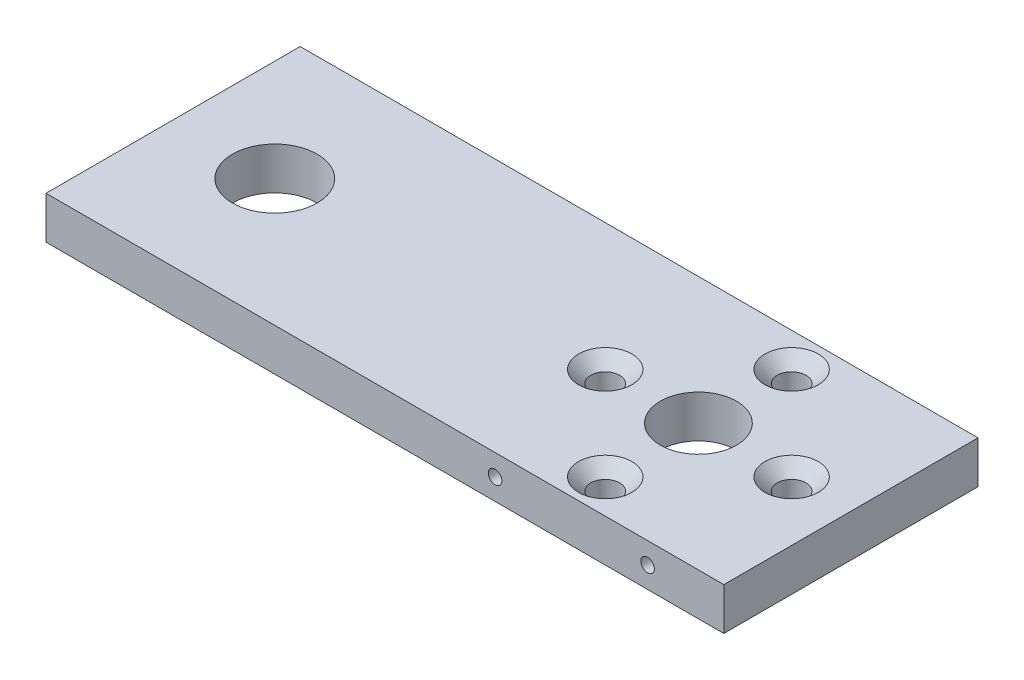
from build123d import *

# Parameters (mm, degrees)
SKETCH1_R                                           = 5
SKETCH1_R_2                                         = 4.5
BOSS_EXTRUDE2_DEPTH                                 = 5
CSK_FOR_M3_COUNTERSUNK_FLAT_HEAD_SCREW2_D           = 3.4
CSK_FOR_M3_COUNTERSUNK_FLAT_HEAD_SCREW2_CSINK_D     = 6.3
CSK_FOR_M3_COUNTERSUNK_FLAT_HEAD_SCREW2_CSINK_ANGLE = 90
CIRPATTERN2_COUNT                                   = 4
M2_TAPPED_HOLE1_D                                   = 1.6
M2_TAPPED_HOLE1_DEPTH                               = 5
M2_TAPPED_HOLE1_TIP                                 = 0.480688495
M2_TAPPED_HOLE2_D                                   = 1.6
M2_TAPPED_HOLE2_DEPTH                               = 5
M2_TAPPED_HOLE2_TIP                                 = 0.480688495


with BuildPart() as part:
    # Sketch1 → Boss-Extrude2 (new body)
    with BuildSketch(Plane(origin=(0, 0, 0), x_dir=(1, 0, 0), z_dir=(0, 1, 0))):
        Polygon((-37.002207947, 0), (-37.002207947, 15), (42.997792053, 15), (42.997792053, -15), (-37.002207947, -15), align=None)
        with Locations((-25, 0)):
            Circle(SKETCH1_R, mode=Mode.SUBTRACT)
        with Locations((25, 0)):
            Circle(SKETCH1_R_2, mode=Mode.SUBTRACT)
    extrude(amount=BOSS_EXTRUDE2_DEPTH)

    # CSK for M3 Countersunk Flat Head Screw2 (through all)
    with Locations(Plane(origin=(0, 5, 0), x_dir=(1, 0, 0), z_dir=(0, 1, 0))):
        with Locations((14, 0)):
            csk_for_m3_countersunk_flat_head_screw2 = CounterSinkHole(CSK_FOR_M3_COUNTERSUNK_FLAT_HEAD_SCREW2_D / 2, CSK_FOR_M3_COUNTERSUNK_FLAT_HEAD_SCREW2_CSINK_D / 2, counter_sink_angle=CSK_FOR_M3_COUNTERSUNK_FLAT_HEAD_SCREW2_CSINK_ANGLE)

    # CirPattern2: CSK for M3 Countersunk Flat Head Screw2 ×4 about axis
    cirpattern2_axis = Axis((25, 23.075275429, 0), (0, -1, 0))
    for i in range(1, CIRPATTERN2_COUNT):
        add(csk_for_m3_countersunk_flat_head_screw2.rotate(cirpattern2_axis, i * 360 / CIRPATTERN2_COUNT), mode=Mode.SUBTRACT)

    # M2 Tapped Hole1
    with Locations(Plane.XY.offset(15)):
        with Locations((15.997792053, 2.5), (33.997792053, 2.5)):
            Hole(M2_TAPPED_HOLE1_D / 2, depth=M2_TAPPED_HOLE1_DEPTH)
            with Locations((0, 0, -(M2_TAPPED_HOLE1_DEPTH + M2_TAPPED_HOLE1_TIP / 2))):  # 118° drill point
                Cone(0, M2_TAPPED_HOLE1_D / 2, M2_TAPPED_HOLE1_TIP, mode=Mode.SUBTRACT)

    # M2 Tapped Hole2
    with Locations(Plane(origin=(0, 0, -15), x_dir=(-1, 0, 0), z_dir=(0, 0, -1))):
        with Locations((-33.997792053, 2.5), (-15.997792053, 2.5)):
            Hole(M2_TAPPED_HOLE2_D / 2, depth=M2_TAPPED_HOLE2_DEPTH)
            with Locations((0, 0, -(M2_TAPPED_HOLE2_DEPTH + M2_TAPPED_HOLE2_TIP / 2))):  # 118° drill point
                Cone(0, M2_TAPPED_HOLE2_D / 2, M2_TAPPED_HOLE2_TIP, mode=Mode.SUBTRACT)


solid = part.part
